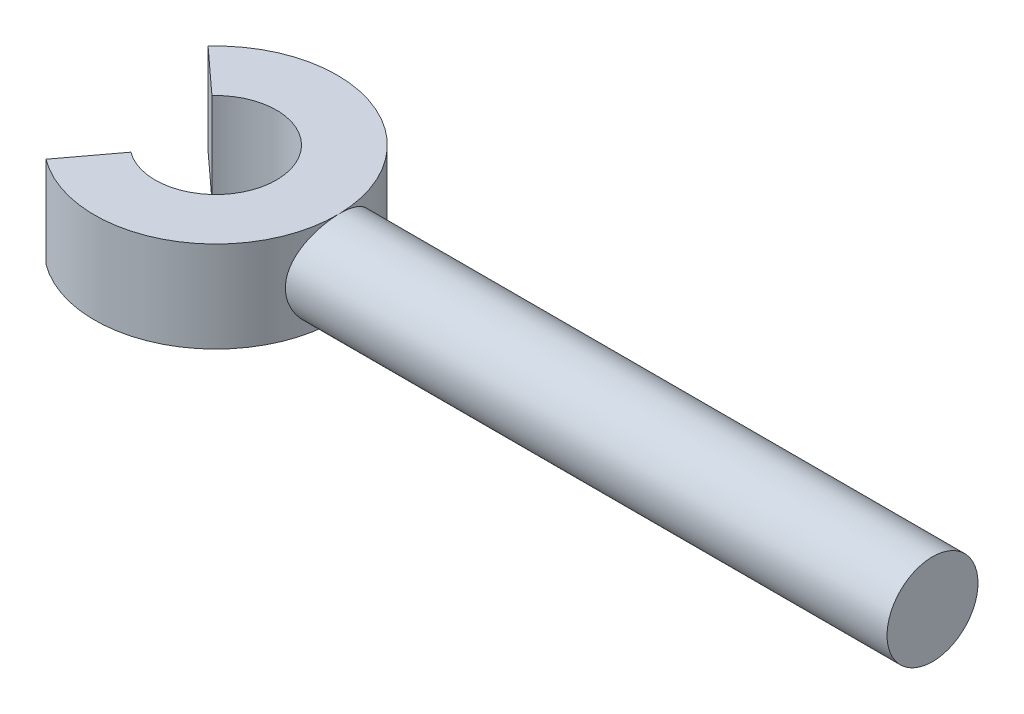
from build123d import *

# Parameters (mm, degrees)
SKETCH1_R                = 0.75
BOSS_EXTRUDE1_DEPTH      = 10
BOSS_EXTRUDE2_DEPTH      = 0.75
BOSS_EXTRUDE2_DEPTH_BACK = 0.75


with BuildPart() as part:
    # Sketch1 → Boss-Extrude1 (new body)
    with BuildSketch(Plane(origin=(0, 0, 0), x_dir=(0, 0, -1), z_dir=(1, 0, 0))):
        Circle(SKETCH1_R)
    extrude(amount=BOSS_EXTRUDE1_DEPTH)

    # Sketch7 → Boss-Extrude2 (add, two sides: drawn at the far end of the back side and taken through both)
    with BuildSketch(Plane(origin=(0, 0, 0), x_dir=(1, 0, 0), z_dir=(0, 1, 0)).offset(-BOSS_EXTRUDE2_DEPTH_BACK)):
        with BuildLine():
            Line((-2.524409689, 0.643789351), (-3.262573031, 1.318411378))
            ThreePointArc((-3.262573031, 1.318411378), (0.204884976, 0.157305716), (-2.983725986, -1.632719849))
            Line((-2.983725986, -1.632719849), (-2.384986166, -0.831776263))
            ThreePointArc((-2.384986166, -0.831776263), (-0.790680685, 0.06323652), (-2.524409689, 0.643789351))
        make_face()
    extrude(amount=BOSS_EXTRUDE2_DEPTH + BOSS_EXTRUDE2_DEPTH_BACK)


solid = part.part
